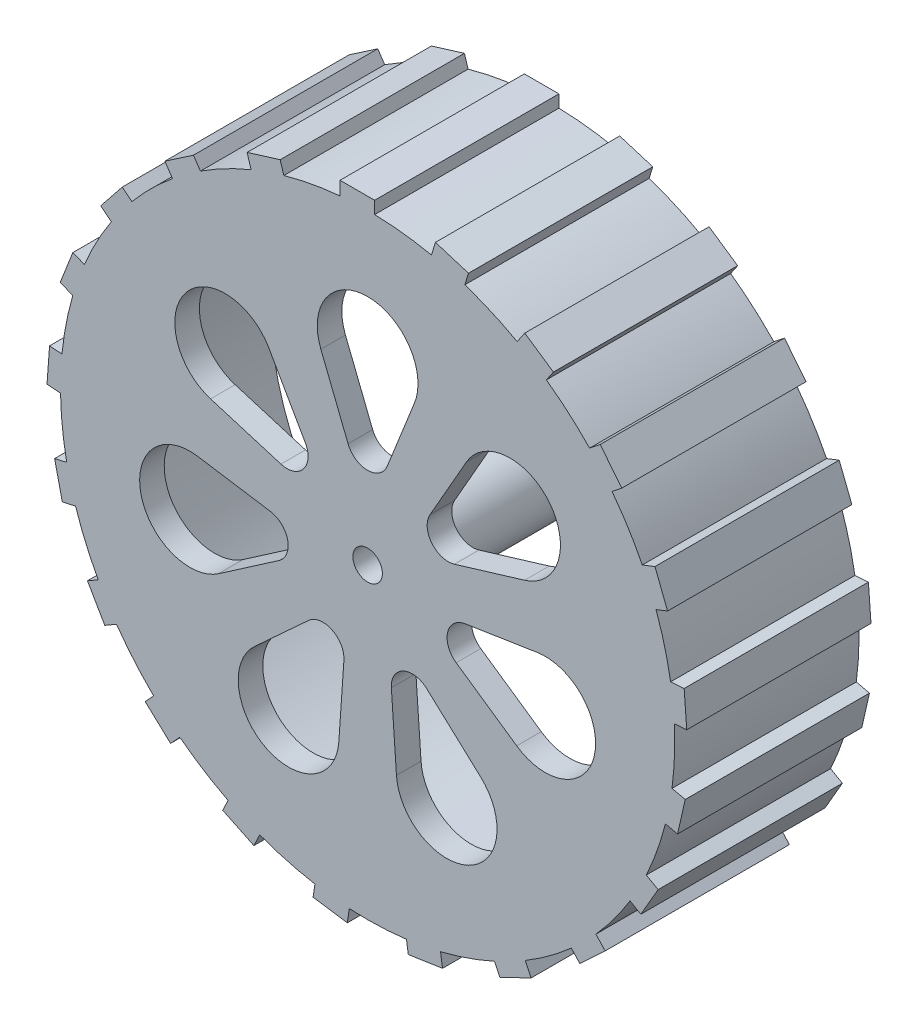
from build123d import *

# Parameters (mm, degrees)
SKETCH1_R           = 125.000000063
SKETCH1_R_2         = 6
BOSS_EXTRUDE1_DEPTH = 75
SHELL1_T            = -10
SKETCH2_W           = 14.078706662
SKETCH2_H           = 10.184362198
BOSS_EXTRUDE2_DEPTH = 75
CIRPATTERN1_COUNT   = 21
CUT_EXTRUDE1_REACH  = 841.155
CIRPATTERN2_COUNT   = 7


with BuildPart() as part:
    # Sketch1 → Boss-Extrude1 (new body)
    with BuildSketch(Plane.XY):
        with Locations((-561.018147545, 339.405473748)):
            Circle(SKETCH1_R)
        with Locations((-561.018147545, 339.405473748)):
            Circle(SKETCH1_R_2, mode=Mode.SUBTRACT)
    extrude(amount=BOSS_EXTRUDE1_DEPTH)

    # Shell1
    shell1_openings = [part.faces().sort_by_distance(p)[0] for p in [
        (-682.482613701, 339.405473748, 0),
    ]]
    offset(amount=SHELL1_T, openings=shell1_openings, kind=Kind.INTERSECTION)

    # Sketch2 → Boss-Extrude2 (add)
    with BuildSketch(Plane.XY.offset(75)):
        with Locations((-565.206583335, 464.335282126)):
            Rectangle(SKETCH2_W, SKETCH2_H)
    boss_extrude2 = extrude(amount=-BOSS_EXTRUDE2_DEPTH)

    # CirPattern1: Boss-Extrude2 ×21 about axis
    cirpattern1_axis = Axis((-561.018147545, 339.405473748, 0), (0, 0, 1))
    for i in range(1, CIRPATTERN1_COUNT):
        add(boss_extrude2.rotate(cirpattern1_axis, i * 360 / CIRPATTERN1_COUNT))

    # Sketch3 → Cut-Extrude1 (cut, up to next)
    with BuildSketch(Plane.XY.offset(75), mode=Mode.PRIVATE) as cut_extrude1_sk1:
        with BuildLine():
            Line((-580.05466288, 405.976634587), (-568.983811085, 378.195048585))
            ThreePointArc((-568.983811085, 378.195048585), (-561.018147545, 372.794493792), (-553.052484006, 378.195048585))
            Line((-553.052484006, 378.195048585), (-541.981632211, 405.976634587))
            ThreePointArc((-541.981632211, 405.976634587), (-561.018147545, 434.054949118), (-580.05466288, 405.976634587))
        make_face()
    cut_extrude1_tool1 = extrude(cut_extrude1_sk1.sketch, amount=-CUT_EXTRUDE1_REACH, mode=Mode.PRIVATE) & part.part
    cut_extrude1 = cut_extrude1_tool1.solids().sort_by_distance((-561.018148, 406.56206, 75))[0]
    add(cut_extrude1, mode=Mode.SUBTRACT)

    # CirPattern2: Cut-Extrude1 ×7 about axis
    cirpattern2_axis = Axis((-561.018147545, 339.405473748, 0), (0, 0, 1))
    for i in range(1, CIRPATTERN2_COUNT):
        add(cut_extrude1.rotate(cirpattern2_axis, i * 360 / CIRPATTERN2_COUNT), mode=Mode.SUBTRACT)


solid = part.part
